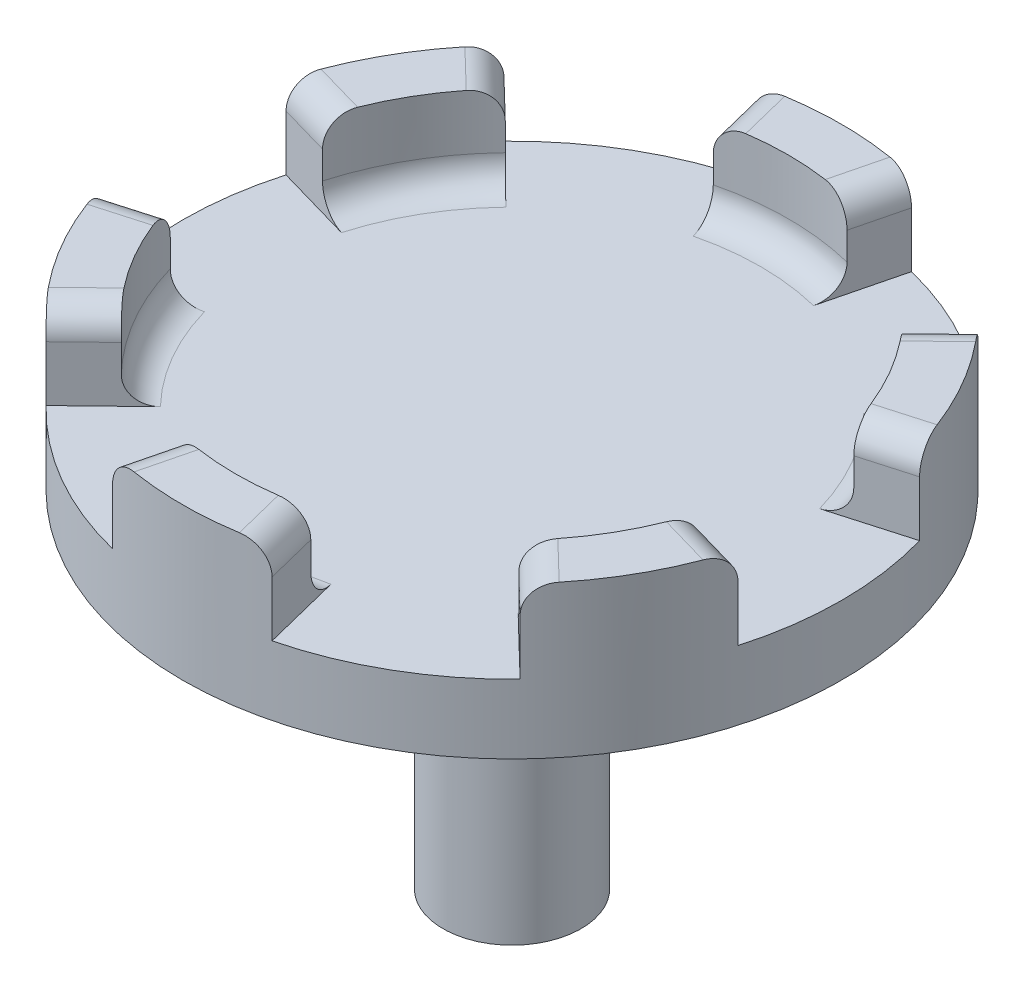
from build123d import *
from build123d.topology import SkipClean

# Parameters (mm, degrees)
SKETCH1_R           = 30.2895
BOSS_EXTRUDE1_DEPTH = 6.35
BOSS_EXTRUDE2_DEPTH = 7.62
FILLET1_R           = 2.54
SKETCH3_R           = 8.89
BOSS_EXTRUDE3_DEPTH = 6.35
FILLET2_R           = 2.54
SKETCH4_R           = 6.35
BOSS_EXTRUDE4_DEPTH = 25.4


with BuildPart() as part:
    # Sketch1 → Boss-Extrude1 (new body)
    with BuildSketch(Plane(origin=(0, 0, 0), x_dir=(1, 0, 0), z_dir=(0, 1, 0))):
        with Locations(Location((0, 0, 0), (0, 0, 270))):
            Circle(SKETCH1_R)
    extrude(amount=BOSS_EXTRUDE1_DEPTH)

    # Sketch2 → Boss-Extrude2 (add)
    with SkipClean():  # the faces are left unmerged after this step: merging them gives an invalid solid
        with BuildSketch(Plane(origin=(0, 6.35, 0), x_dir=(1, 0, 0), z_dir=(0, 1, 0))):
            with BuildLine():
                ThreePointArc((6.148158832, -24.644677782), (0, -25.4), (-6.148158832, -24.644677782))
                Line((-6.148158832, -24.644677782), (-7.331679408, -29.388778255))
                ThreePointArc((-7.331679408, -29.388778255), (0, -30.2895), (7.331679408, -29.388778255))
                Line((7.331679408, -29.388778255), (6.148158832, -24.644677782))
            make_face()
            with BuildLine():
                Line((18.268837611, -17.646800626), (21.785588851, -21.043809747))
                ThreePointArc((21.785588851, -21.043809747), (26.231476468, -15.14475), (29.117268259, -8.344968508))
                Line((29.117268259, -8.344968508), (24.416996443, -6.997877156))
                ThreePointArc((24.416996443, -6.997877156), (21.997045256, -12.7), (18.268837611, -17.646800626))
            make_face()
            with BuildLine():
                Line((24.416996443, 6.997877156), (29.117268259, 8.344968508))
                ThreePointArc((29.117268259, 8.344968508), (26.231476468, 15.14475), (21.785588851, 21.043809747))
                Line((21.785588851, 21.043809747), (18.268837611, 17.646800626))
                ThreePointArc((18.268837611, 17.646800626), (21.997045256, 12.7), (24.416996443, 6.997877156))
            make_face()
            with BuildLine():
                ThreePointArc((-21.785588851, 21.043809747), (-26.231476468, 15.14475), (-29.117268259, 8.344968508))
                Line((-29.117268259, 8.344968508), (-24.416996443, 6.997877156))
                ThreePointArc((-24.416996443, 6.997877156), (-21.997045256, 12.7), (-18.268837611, 17.646800626))
                Line((-18.268837611, 17.646800626), (-21.785588851, 21.043809747))
            make_face()
            with BuildLine():
                ThreePointArc((-29.117268259, -8.344968508), (-26.231476468, -15.14475), (-21.785588851, -21.043809747))
                Line((-21.785588851, -21.043809747), (-18.268837611, -17.646800626))
                ThreePointArc((-18.268837611, -17.646800626), (-21.997045256, -12.7), (-24.416996443, -6.997877156))
                Line((-24.416996443, -6.997877156), (-29.117268259, -8.344968508))
            make_face()
            with BuildLine():
                ThreePointArc((-7.331679408, 29.388778255), (0, 30.2895), (7.331679408, 29.388778255))
                Line((7.331679408, 29.388778255), (6.148158832, 24.644677782))
                ThreePointArc((6.148158832, 24.644677782), (0, 25.4), (-6.148158832, 24.644677782))
                Line((-6.148158832, 24.644677782), (-7.331679408, 29.388778255))
            make_face()
        extrude(amount=BOSS_EXTRUDE2_DEPTH)

    # Fillet1
    fillet1_edges = [part.edges().sort_by_distance(p)[0] for p in [
        (26.767132351, 13.97, 7.671422832),
        (20.027213231, 13.97, 19.345305187),
        (20.027213231, 13.97, -19.345305187),
        (26.767132351, 13.97, -7.671422832),
        (-26.767132351, 13.97, -7.671422832),
        (-20.027213231, 13.97, -19.345305187),
        (-20.027213231, 13.97, 19.345305187),
        (-26.767132351, 13.97, 7.671422832),
        (-6.73991912, 13.97, -27.016728018),
        (6.73991912, 13.97, -27.016728018),
        (6.73991912, 13.97, 27.016728018),
        (-6.73991912, 13.97, 27.016728018),
    ]]
    fillet(fillet1_edges, radius=FILLET1_R)

    # Sketch3 → Boss-Extrude3 (add)
    with BuildSketch(Plane.XZ):
        with Locations(Location((0, 0, 0), (0, 0, 270))):
            Circle(SKETCH3_R)
    extrude(amount=BOSS_EXTRUDE3_DEPTH)

    # Fillet2
    fillet2_edges = [part.edges().sort_by_distance(p)[0] for p in [
        (21.997045256, 6.35, 12.7),
        (21.997045256, 6.35, -12.7),
        (-21.997045256, 6.35, -12.7),
        (-21.997045256, 6.35, 12.7),
        (0, 6.35, -25.4),
        (0, 6.35, 25.4),
    ]]
    fillet(fillet2_edges, radius=FILLET2_R)

    # Sketch4 → Boss-Extrude4 (add)
    with BuildSketch(Plane.XZ.offset(6.35)):
        with Locations(Location((0, 0, 0), (0, 0, 270))):
            Circle(SKETCH4_R)
    extrude(amount=BOSS_EXTRUDE4_DEPTH)


solid = part.part
